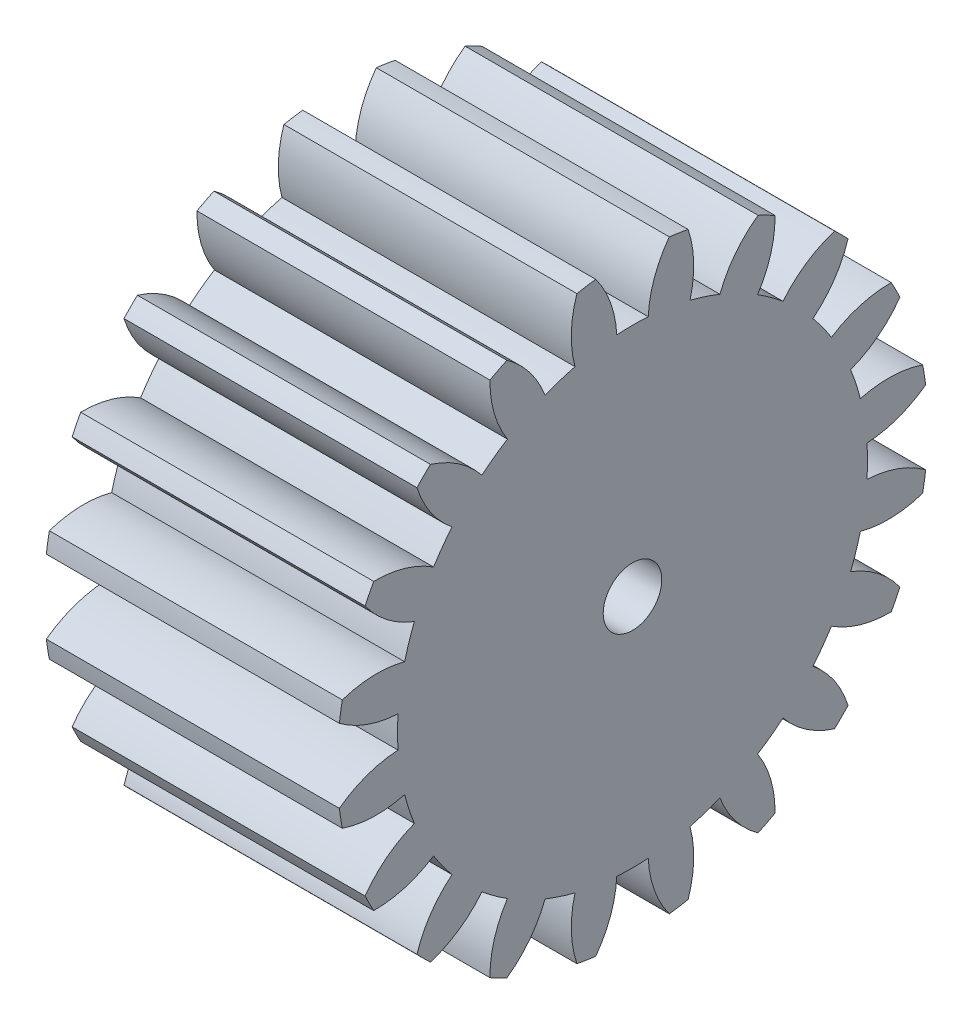
from build123d import *

# Parameters (mm, degrees)
BASPROSKE_W     = 15
BASPROSKE_H     = 15.125
TOOTHCUT_DEPTH  = 27.125299041
TEETHCUTS_COUNT = 20
BORSKE_R        = 1.5
BORE_DEPTH      = 50.0000508


with BuildPart() as part:
    # BasProSke → Base-Revolve (revolve)
    with BuildSketch(Plane(origin=(0, 0, 0), x_dir=(1, 0, 0), z_dir=(0, 1, 0)), mode=Mode.PRIVATE) as base_revolve_sk:
        with Locations((7.5, 7.5625)):
            Rectangle(BASPROSKE_W, BASPROSKE_H)
    revolve(base_revolve_sk.sketch.rotate(Axis((-10, 0, 0), (1, 0, 0)), 180), axis=Axis((-10, 0, 0), (1, 0, 0)))

    # TooCutSke → ToothCut (cut, through all)
    with BuildSketch(Plane(origin=(0, 0, 0), x_dir=(0, 0, -1), z_dir=(1, 0, 0))):
        with BuildLine():
            ThreePointArc((0.805402304, 12.003259649), (0, 12.03025), (-0.805402304, 12.003259649))
            ThreePointArc((-0.805402304, 12.003259649), (-1.12659346, 13.598917809), (-1.900738704, 15.030695677))
            ThreePointArc((-1.900738704, 15.030695677), (0, 15.1504), (1.900738704, 15.030695677))
            ThreePointArc((1.900738704, 15.030695677), (1.12659346, 13.598917809), (0.805402304, 12.003259649))
        make_face()
    toothcut = extrude(amount=TOOTHCUT_DEPTH, mode=Mode.SUBTRACT)

    # TeethCuts: ToothCut ×20 about axis
    teethcuts_axis = Axis((0, 0, 0), (1, 0, 0))
    for i in range(1, TEETHCUTS_COUNT):
        add(toothcut.rotate(teethcuts_axis, i * 360 / TEETHCUTS_COUNT), mode=Mode.SUBTRACT)

    # BorSke → Bore (cut, symmetric)
    with BuildSketch(Plane(origin=(0, 0, 0), x_dir=(0, 0, -1), z_dir=(1, 0, 0))):
        with Locations(Location((0, 0, 0), (0, 0, 180))):
            Circle(BORSKE_R)
    extrude(amount=BORE_DEPTH, both=True, mode=Mode.SUBTRACT)


solid = part.part
